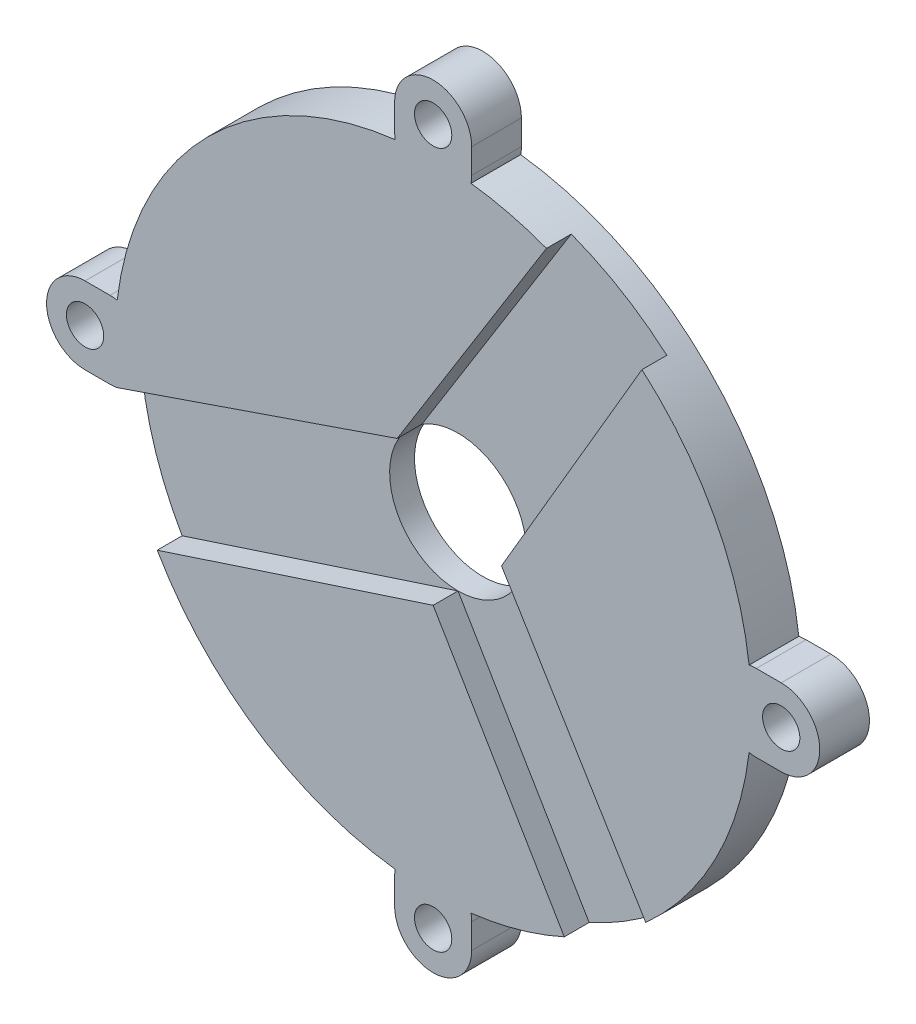
from build123d import *

# Parameters (mm, degrees)
SKETCH4_R           = 5.5
SKETCH4_R_2         = 1.5
BOSS_EXTRUDE2_DEPTH = 4
CUT_EXTRUDE1_START  = -2
CUT_EXTRUDE1_DEPTH  = 2


with BuildPart() as part:
    # Sketch4 → Boss-Extrude2 (new body)
    with BuildSketch(Plane.XY):
        with BuildLine():
            Line((28, 3.1), (26, 3.1))
            ThreePointArc((26, 3.1), (25.707834138, 3.086201405), (25.418269231, 3.044928458))
            ThreePointArc((25.418269231, 3.044928458), (18.101933598, 18.101933598), (3.044928458, 25.418269231))
            ThreePointArc((3.044928458, 25.418269231), (3.086201405, 25.707834138), (3.1, 26))
            Line((3.1, 26), (3.1, 28))
            ThreePointArc((3.1, 28), (0, 31.1), (-3.1, 28))
            Line((-3.1, 28), (-3.1, 26))
            ThreePointArc((-3.1, 26), (-3.086201405, 25.707834138), (-3.044928458, 25.418269231))
            ThreePointArc((-3.044928458, 25.418269231), (-18.101933598, 18.101933598), (-25.418269231, 3.044928458))
            ThreePointArc((-25.418269231, 3.044928458), (-25.707834138, 3.086201405), (-26, 3.1))
            Line((-26, 3.1), (-28, 3.1))
            ThreePointArc((-28, 3.1), (-31.1, 0), (-28, -3.1))
            Line((-28, -3.1), (-26, -3.1))
            ThreePointArc((-26, -3.1), (-25.707834138, -3.086201405), (-25.418269231, -3.044928458))
            ThreePointArc((-25.418269231, -3.044928458), (-18.101933598, -18.101933598), (-3.044928458, -25.418269231))
            ThreePointArc((-3.044928458, -25.418269231), (-3.086201405, -25.707834138), (-3.1, -26))
            Line((-3.1, -26), (-3.1, -28))
            ThreePointArc((-3.1, -28), (0, -31.1), (3.1, -28))
            Line((3.1, -28), (3.1, -26))
            ThreePointArc((3.1, -26), (3.086201405, -25.707834138), (3.044928458, -25.418269231))
            ThreePointArc((3.044928458, -25.418269231), (18.101933598, -18.101933598), (25.418269231, -3.044928458))
            ThreePointArc((25.418269231, -3.044928458), (25.707834138, -3.086201405), (26, -3.1))
            Line((26, -3.1), (28, -3.1))
            ThreePointArc((28, -3.1), (31.1, 0), (28, 3.1))
        make_face()
        Circle(SKETCH4_R, mode=Mode.SUBTRACT)
        with Locations((-28, 0)):
            Circle(SKETCH4_R_2, mode=Mode.SUBTRACT)
        with Locations((0, 28)):
            Circle(SKETCH4_R_2, mode=Mode.SUBTRACT)
        with Locations((28, 0)):
            Circle(SKETCH4_R_2, mode=Mode.SUBTRACT)
        with Locations((0, -28)):
            Circle(SKETCH4_R_2, mode=Mode.SUBTRACT)
    extrude(amount=BOSS_EXTRUDE2_DEPTH)

    # Sketch5 → Cut-Extrude1 (cut)
    with BuildSketch(Plane.XY.offset(4).offset(CUT_EXTRUDE1_START)):
        with BuildLine():
            Line((-25.418269231, -3.044928458), (-2.892398424, 4.678037126))
            Line((-2.892398424, 4.678037126), (9.11402937, 23.92267687))
            ThreePointArc((9.11402937, 23.92267687), (13.159458029, 21.958794693), (16.798827647, 19.317333918))
            Line((16.798827647, 19.317333918), (5.5, 0))
            Line((5.5, 0), (17.104166933, -19.047505704))
            ThreePointArc((17.104166933, -19.047505704), (13.991450126, -21.438267733), (10.549853348, -23.325106524))
            Line((10.549853348, -23.325106524), (0, -5.5))
            Line((0, -5.5), (-22.195690438, -12.755834977))
            ThreePointArc((-22.195690438, -12.755834977), (-24.297072153, -8.063019583), (-25.418269231, -3.044928458))
        make_face()
    extrude(amount=CUT_EXTRUDE1_DEPTH, mode=Mode.SUBTRACT)


solid = part.part
